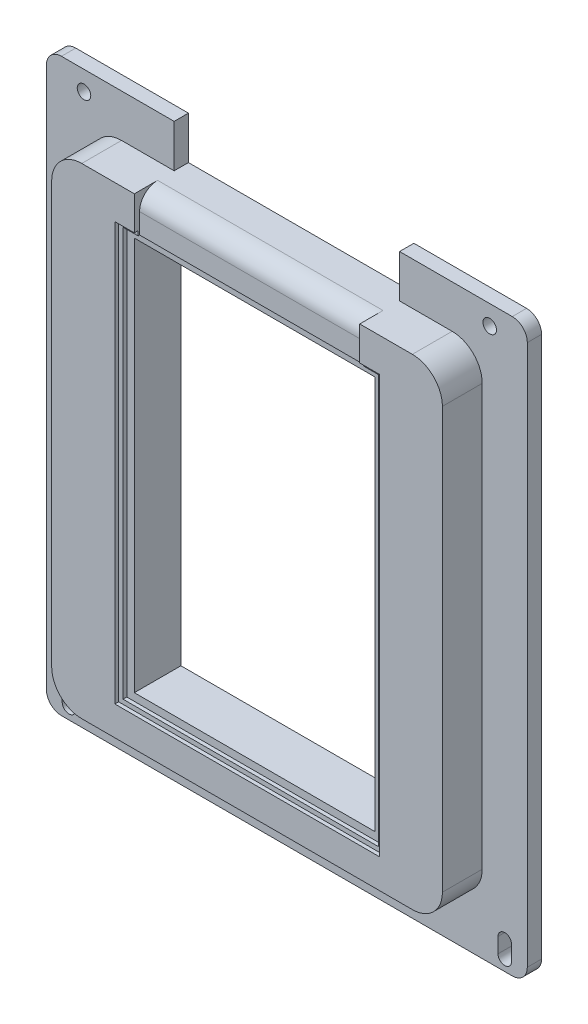
from build123d import *

# Parameters (mm, degrees)
SKETCH1_W           = 160
SKETCH1_H           = 190
BOSS_EXTRUDE1_DEPTH = 18
SKETCH3_W           = 160
SKETCH3_H           = 14.25
CUT_EXTRUDE2_DEPTH  = 13.25
SKETCH4_W           = 160
SKETCH4_H           = 15.75
CUT_EXTRUDE3_DEPTH  = 13.25
SKETCH2_R           = 2.25
CUT_EXTRUDE1_DEPTH  = 126.495019822
SKETCH5_W           = 80
SKETCH5_H           = 131
CUT_EXTRUDE4_DEPTH  = 126.495019822
SKETCH6_W           = 85
SKETCH6_H           = 136
CUT_EXTRUDE5_DEPTH  = 2.5
SKETCH7_W           = 75
SKETCH7_H           = 12.75
CUT_EXTRUDE6_DEPTH  = 1.75
SKETCH8_W           = 88
SKETCH8_H           = 139
CUT_EXTRUDE7_DEPTH  = 1.25
SKETCH9_W           = 75
SKETCH9_H           = 14.25
CUT_EXTRUDE8_DEPTH  = 125.90221175
FILLET1_R           = 6
SKETCH10_W          = 15
SKETCH10_H          = 160
CUT_EXTRUDE9_DEPTH  = 13.25
CUT_EXTRUDE10_DEPTH = 126.495019822
FILLET2_R           = 10
FILLET3_R           = 5


with BuildPart() as part:
    # Sketch1 → Boss-Extrude1 (new body)
    with BuildSketch(Plane.XY):
        Rectangle(SKETCH1_W, SKETCH1_H)
    extrude(amount=BOSS_EXTRUDE1_DEPTH)

    # Sketch3 → Cut-Extrude2 (cut)
    with BuildSketch(Plane.XY.offset(18)):
        with Locations((0, 87.875)):
            Rectangle(SKETCH3_W, SKETCH3_H)
    extrude(amount=-CUT_EXTRUDE2_DEPTH, mode=Mode.SUBTRACT)

    # Sketch4 → Cut-Extrude3 (cut)
    with BuildSketch(Plane.XY.offset(18)):
        with Locations((0, -87.125)):
            Rectangle(SKETCH4_W, SKETCH4_H)
    extrude(amount=-CUT_EXTRUDE3_DEPTH, mode=Mode.SUBTRACT)

    # Sketch2 → Cut-Extrude1 (cut, through all)
    with BuildSketch(Plane(origin=(0, 0, 0), x_dir=(-1, 0, 0), z_dir=(0, 0, -1))):
        with Locations((-67.5, 88.5)):
            Circle(SKETCH2_R)
        with Locations((67.5, 88.5)):
            Circle(SKETCH2_R)
        with Locations((-72.5, -88.5)):
            Circle(SKETCH2_R)
        with Locations((72.5, -88.5)):
            Circle(SKETCH2_R)
    extrude(amount=-CUT_EXTRUDE1_DEPTH, mode=Mode.SUBTRACT)

    # Sketch5 → Cut-Extrude4 (cut, through all)
    with BuildSketch(Plane.XY.offset(18)):
        Rectangle(SKETCH5_W, SKETCH5_H)
    extrude(amount=-CUT_EXTRUDE4_DEPTH, mode=Mode.SUBTRACT)

    # Sketch6 → Cut-Extrude5 (cut)
    with BuildSketch(Plane.XY.offset(18)):
        Rectangle(SKETCH6_W, SKETCH6_H)
    extrude(amount=-CUT_EXTRUDE5_DEPTH, mode=Mode.SUBTRACT)

    # Sketch7 → Cut-Extrude6 (cut)
    with BuildSketch(Plane.XY.offset(18)):
        with Locations((0, 74.375)):
            Rectangle(SKETCH7_W, SKETCH7_H)
    extrude(amount=-CUT_EXTRUDE6_DEPTH, mode=Mode.SUBTRACT)

    # Sketch8 → Cut-Extrude7 (cut)
    with BuildSketch(Plane.XY.offset(18)):
        Rectangle(SKETCH8_W, SKETCH8_H)
    extrude(amount=-CUT_EXTRUDE7_DEPTH, mode=Mode.SUBTRACT)

    # Sketch9 → Cut-Extrude8 (cut, through all)
    with BuildSketch(Plane.XY.offset(4.75)):
        with Locations((0, 87.875)):
            Rectangle(SKETCH9_W, SKETCH9_H)
    extrude(amount=-CUT_EXTRUDE8_DEPTH, mode=Mode.SUBTRACT)

    # Fillet1
    fillet1_edges = [part.edges().sort_by_distance(p)[0] for p in [
        (0, 80.75, 16.25),
    ]]
    fillet(fillet1_edges, radius=FILLET1_R)

    # Sketch10 → Cut-Extrude9 (cut)
    with BuildSketch(Plane.XY.offset(18)):
        with Locations((72.5, 0.75)):
            Rectangle(SKETCH10_W, SKETCH10_H)
        with Locations((-72.5, 0.75)):
            Rectangle(SKETCH10_W, SKETCH10_H)
    extrude(amount=-CUT_EXTRUDE9_DEPTH, mode=Mode.SUBTRACT)

    # Sketch11 → Cut-Extrude10 (cut, through all)
    with BuildSketch(Plane(origin=(0, 0, 0), x_dir=(-1, 0, 0), z_dir=(0, 0, -1))):
        with BuildLine():
            Line((-74.75, -91), (-74.75, -86))
            ThreePointArc((-74.75, -86), (-72.5, -83.75), (-70.25, -86))
            Line((-70.25, -86), (-70.25, -91))
            ThreePointArc((-70.25, -91), (-72.5, -93.25), (-74.75, -91))
        make_face()
        with BuildLine():
            Line((70.25, -91), (70.25, -86))
            ThreePointArc((70.25, -86), (72.5, -83.75), (74.75, -86))
            Line((74.75, -86), (74.75, -91))
            ThreePointArc((74.75, -91), (72.5, -93.25), (70.25, -91))
        make_face()
    extrude(amount=-CUT_EXTRUDE10_DEPTH, mode=Mode.SUBTRACT)

    # Fillet2
    fillet2_edges = [part.edges().sort_by_distance(p)[0] for p in [
        (65, 80.75, 11.375),
        (65, -79.25, 11.375),
        (-65, -79.25, 11.375),
        (-65, 80.75, 11.375),
    ]]
    fillet(fillet2_edges, radius=FILLET2_R)

    # Fillet3
    fillet3_edges = [part.edges().sort_by_distance(p)[0] for p in [
        (-80, 95, 2.375),
        (80, 95, 2.375),
        (80, -95, 2.375),
        (-80, -95, 2.375),
    ]]
    fillet(fillet3_edges, radius=FILLET3_R)


solid = part.part
